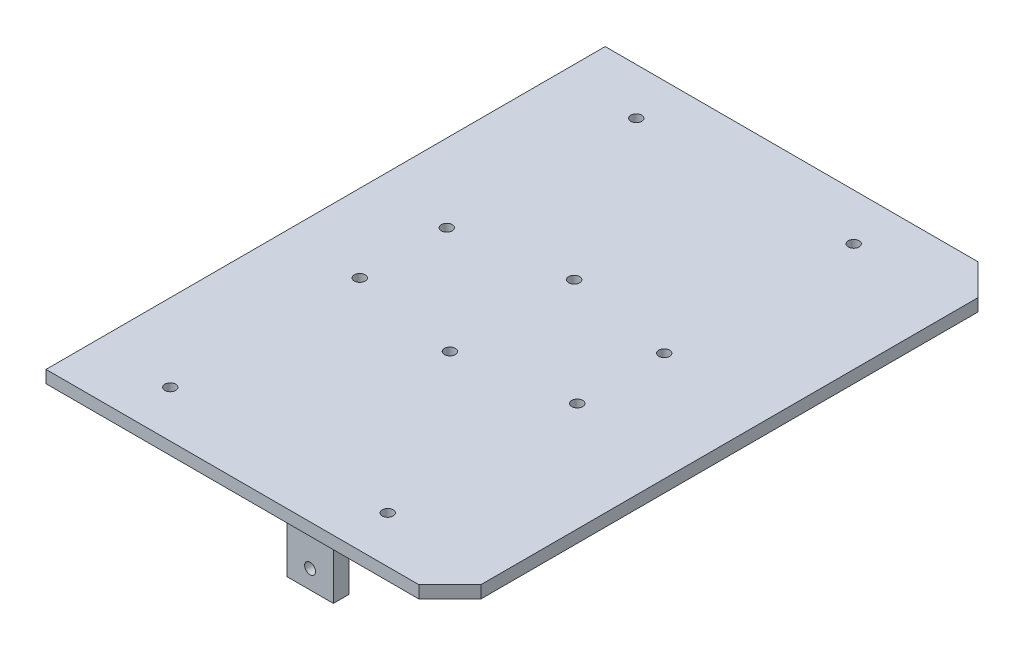
from build123d import *

# Parameters (mm, degrees)
SKETCH1_W               = 300
SKETCH1_H               = 180
MAIN_BODY_DEPTH         = 4
FILLET1_R               = 10
CHAMFER1_SIZE           = 10
SKETCH2_R               = 1.75
BATTERIES_HOLES_DEPTH   = 15
SKETCH5_R               = 1.75
SKETCH5_W               = 15
SKETCH5_H               = 10
L298N_HOLES_DEPTH       = 15
SKETCH6_R               = 1.75
LM2596_HOLES_DEPTH      = 15
SKETCH7_R               = 1.55
ESP32_HOLES_DEPTH       = 15
SKETCH8_R               = 1.75
PCB_SENSORS_HOLES_DEPTH = 15
SKETCH9_W               = 15
SKETCH9_H               = 5
WHEELS_LEGS_DEPTH       = 30
SKETCH10_R              = 1.75
MOTOR_HOLES_DEPTH       = 300
SKETCH11_R              = 1.75
SKETCH11_W              = 30
SKETCH11_H              = 20
SENSORS_HOLES_DEPTH     = 15
SKETCH13_W              = 40
SKETCH13_H              = 75
CUT_EXTRUDE2_DEPTH      = 10
FILLET2_R               = 10
SKETCH12_R              = 1.75
CUT_EXTRUDE3_DEPTH      = 10
SKETCH14_W              = 212.137898895
SKETCH14_H              = 97.482026014
CUT_EXTRUDE4_DEPTH      = 200


with BuildPart() as part:
    # Sketch1 → Main Body (new body)
    with BuildSketch(Plane(origin=(0, 0, 0), x_dir=(1, 0, 0), z_dir=(0, 1, 0))):
        Rectangle(SKETCH1_W, SKETCH1_H)
    extrude(amount=MAIN_BODY_DEPTH)

    # Fillet1
    fillet1_edges = [part.edges().sort_by_distance(p)[0] for p in [
        (-150, 2, 90),
        (-150, 2, -90),
    ]]
    fillet(fillet1_edges, radius=FILLET1_R)

    # Chamfer1
    chamfer1_edges = [part.edges().sort_by_distance(p)[0] for p in [
        (150, 2, 90),
        (150, 2, -90),
    ]]
    chamfer(chamfer1_edges, length=CHAMFER1_SIZE)

    # Sketch2 → Batteries holes (cut)
    with BuildSketch(Plane(origin=(0, 4, 0), x_dir=(1, 0, 0), z_dir=(0, 1, 0))):
        with Locations((115, 75)):
            Circle(SKETCH2_R)
        with Locations((115, 14)):
            Circle(SKETCH2_R)
        with Locations((115, -14)):
            Circle(SKETCH2_R)
        with Locations((115, -75)):
            Circle(SKETCH2_R)
        with Locations((45, -75)):
            Circle(SKETCH2_R)
        with Locations((45, -14)):
            Circle(SKETCH2_R)
        with Locations((45, 14)):
            Circle(SKETCH2_R)
        with Locations((45, 75)):
            Circle(SKETCH2_R)
    extrude(amount=-BATTERIES_HOLES_DEPTH, mode=Mode.SUBTRACT)

    # Sketch5 → L298N holes (cut)
    with BuildSketch(Plane(origin=(0, 4, 0), x_dir=(1, 0, 0), z_dir=(0, 1, 0))):
        with Locations((-37, 18.5)):
            Circle(SKETCH5_R)
        with Locations((0, 18.5)):
            Circle(SKETCH5_R)
        with Locations((-37, -18.5)):
            Circle(SKETCH5_R)
        with Locations((0, -18.5)):
            Circle(SKETCH5_R)
        with Locations((-12.5, -38.5)):
            Rectangle(SKETCH5_W, SKETCH5_H)
        with Locations((-12.5, 38.5)):
            Rectangle(SKETCH5_W, SKETCH5_H)
    extrude(amount=-L298N_HOLES_DEPTH, mode=Mode.SUBTRACT)

    # Sketch6 → LM2596 holes (cut)
    with BuildSketch(Plane(origin=(0, 4, 0), x_dir=(1, 0, 0), z_dir=(0, 1, 0))):
        with Locations((-33, 70)):
            Circle(SKETCH6_R)
        with Locations((-3, 54)):
            Circle(SKETCH6_R)
        with Locations((-33, -54)):
            Circle(SKETCH6_R)
        with Locations((-3, -70)):
            Circle(SKETCH6_R)
    extrude(amount=-LM2596_HOLES_DEPTH, mode=Mode.SUBTRACT)

    # Sketch7 → ESP32 holes (cut)
    with BuildSketch(Plane(origin=(0, 4, 0), x_dir=(1, 0, 0), z_dir=(0, 1, 0))):
        with Locations((-73, 65)):
            Circle(SKETCH7_R)
        with Locations((-73, 19)):
            Circle(SKETCH7_R)
        with Locations((-91, 19)):
            Circle(SKETCH7_R)
    extrude(amount=-ESP32_HOLES_DEPTH, mode=Mode.SUBTRACT)

    # Sketch8 → PCB sensors holes (cut)
    with BuildSketch(Plane(origin=(0, 4, 0), x_dir=(1, 0, 0), z_dir=(0, 1, 0))):
        with Locations((-103, -54)):
            Circle(SKETCH8_R)
        with Locations((-68, -54)):
            Circle(SKETCH8_R)
    extrude(amount=-PCB_SENSORS_HOLES_DEPTH, mode=Mode.SUBTRACT)

    # Sketch9 → Wheels legs (add)
    with BuildSketch(Plane.XZ):
        with Locations((-90, 72.5)):
            Rectangle(SKETCH9_W, SKETCH9_H)
        with Locations((90, 72.5)):
            Rectangle(SKETCH9_W, SKETCH9_H)
        with Locations((90, -72.5)):
            Rectangle(SKETCH9_W, SKETCH9_H)
        with Locations((-90, -72.5)):
            Rectangle(SKETCH9_W, SKETCH9_H)
    extrude(amount=WHEELS_LEGS_DEPTH)

    # Sketch10 → Motor holes (cut)
    with BuildSketch(Plane.XY.offset(75)):
        with Locations((-90, -24)):
            Circle(SKETCH10_R)
        with Locations((-90, -6)):
            Circle(SKETCH10_R)
        with Locations((90, -6)):
            Circle(SKETCH10_R)
        with Locations((90, -24)):
            Circle(SKETCH10_R)
    extrude(amount=-MOTOR_HOLES_DEPTH, mode=Mode.SUBTRACT)

    # Sketch11 → Sensors holes (cut)
    with BuildSketch(Plane(origin=(0, 4, 0), x_dir=(1, 0, 0), z_dir=(0, 1, 0))):
        with Locations((-140, 10)):
            Circle(SKETCH11_R)
        with Locations((-125, 10)):
            Circle(SKETCH11_R)
        with Locations((-125, 30)):
            Circle(SKETCH11_R)
        with Locations((-140, 30)):
            Circle(SKETCH11_R)
        with Locations((-125, -30)):
            Circle(SKETCH11_R)
        with Locations((-140, -30)):
            Circle(SKETCH11_R)
        with Locations((-125, -10)):
            Circle(SKETCH11_R)
        with Locations((-140, -10)):
            Circle(SKETCH11_R)
        with Locations((-85, 0)):
            Rectangle(SKETCH11_W, SKETCH11_H)
    extrude(amount=-SENSORS_HOLES_DEPTH, mode=Mode.SUBTRACT)

    # Sketch13 → Cut-Extrude2 (cut)
    with BuildSketch(Plane.XZ):
        with Locations((-133, 75.5)):
            Rectangle(SKETCH13_W, SKETCH13_H)
        with Locations((-133, -75.5)):
            Rectangle(SKETCH13_W, SKETCH13_H)
    extrude(amount=-CUT_EXTRUDE2_DEPTH, mode=Mode.SUBTRACT)

    # Fillet2
    fillet2_edges = [part.edges().sort_by_distance(p)[0] for p in [
        (-113, 2, -90),
        (-113, 2, -38),
        (-150, 2, -38),
        (-150, 2, 38),
        (-113, 2, 90),
        (-113, 2, 38),
    ]]
    fillet(fillet2_edges, radius=FILLET2_R)

    # Sketch12 → Cut-Extrude3 (cut)
    with BuildSketch(Plane(origin=(0, 4, 0), x_dir=(1, 0, 0), z_dir=(0, 1, 0))):
        with Locations((80, 20)):
            Circle(SKETCH12_R)
        with Locations((80, -20)):
            Circle(SKETCH12_R)
        with Locations((-20, -20)):
            Circle(SKETCH12_R)
        with Locations((-20, 20)):
            Circle(SKETCH12_R)
    extrude(amount=-CUT_EXTRUDE3_DEPTH, mode=Mode.SUBTRACT)

    # Sketch14 → Cut-Extrude4 (cut)
    with BuildSketch(Plane.ZY.offset(-20)):
        with Locations((1.063142902, -9.465230627)):
            Rectangle(SKETCH14_W, SKETCH14_H)
    extrude(amount=CUT_EXTRUDE4_DEPTH, mode=Mode.SUBTRACT)


solid = part.part
